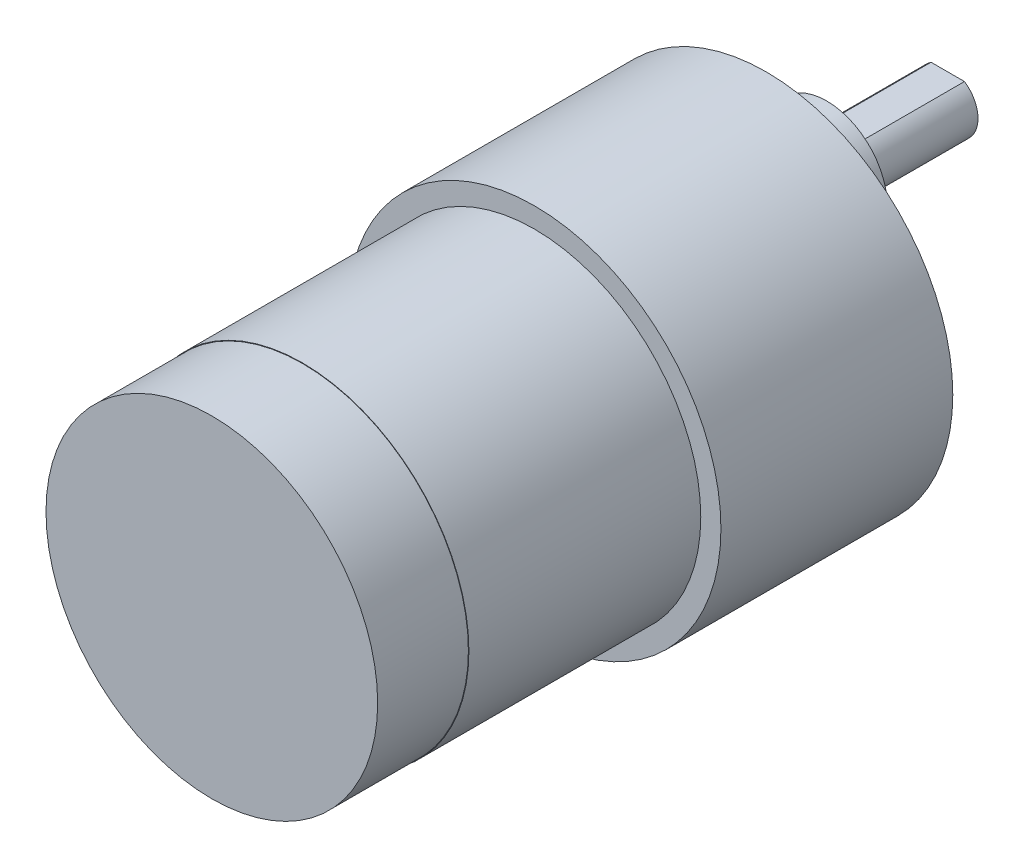
from build123d import *

# Parameters (mm, degrees)
SKETCH1_R           = 18.5
BOSS_EXTRUDE1_DEPTH = 23
SKETCH2_R           = 16.5
BOSS_EXTRUDE2_DEPTH = 23
SKETCH3_R           = 6
BOSS_EXTRUDE3_DEPTH = 6
SKETCH4_R           = 3
BOSS_EXTRUDE4_DEPTH = 12
SKETCH5_W           = 6
SKETCH5_H           = 11.5
CUT_EXTRUDE1_DEPTH  = 12
CIRPATTERN1_COUNT   = 6
SKETCH9_R           = 16.45
BOSS_EXTRUDE5_DEPTH = 9


with BuildPart() as part:
    # Sketch1 → Boss-Extrude1 (new body)
    with BuildSketch(Plane.XY):
        Circle(SKETCH1_R)
    extrude(amount=BOSS_EXTRUDE1_DEPTH)

    # Sketch2 → Boss-Extrude2 (add)
    with BuildSketch(Plane.XY.offset(23)):
        Circle(SKETCH2_R)
    extrude(amount=BOSS_EXTRUDE2_DEPTH)

    # Sketch3 → Boss-Extrude3 (add)
    with BuildSketch(Plane(origin=(0, 0, 0), x_dir=(-1, 0, 0), z_dir=(0, 0, -1))):
        with Locations(Location((0, 7, 0), (0, 0, 180))):
            Circle(SKETCH3_R)
    extrude(amount=BOSS_EXTRUDE3_DEPTH)

    # Sketch4 → Boss-Extrude4 (add)
    with BuildSketch(Plane(origin=(0, 0, -6), x_dir=(-1, 0, 0), z_dir=(0, 0, -1))):
        with Locations((0, 7)):
            Circle(SKETCH4_R)
    extrude(amount=BOSS_EXTRUDE4_DEPTH)

    # Sketch5 → Cut-Extrude1 (cut)
    with BuildSketch(Plane(origin=(0, 9.5, 0), x_dir=(1, 0, 0), z_dir=(0, 1, 0))):
        with Locations((0, 12.25)):
            Rectangle(SKETCH5_W, SKETCH5_H)
    extrude(amount=CUT_EXTRUDE1_DEPTH, mode=Mode.SUBTRACT)

    # Sketch8 → M3 Tapped Hole1 (revolve, cut)
    with BuildSketch(Plane.YZ.offset(15.5)):
        Polygon((0, 0), (0, 5.751075774), (1.25, 5), (1.25, 0), align=None)
    m3_tapped_hole1 = revolve(axis=Axis((15.5, 0, -6.35), (0, 0, 1)), mode=Mode.SUBTRACT)

    # CirPattern1: M3 Tapped Hole1 ×6 about axis
    cirpattern1_axis = Axis((0, 0, 0), (0, 0, 1))
    for i in range(1, CIRPATTERN1_COUNT):
        add(m3_tapped_hole1.rotate(cirpattern1_axis, i * 360 / CIRPATTERN1_COUNT), mode=Mode.SUBTRACT)

    # Sketch9 → Boss-Extrude5 (add)
    with BuildSketch(Plane.XY.offset(46)):
        Circle(SKETCH9_R)
    extrude(amount=BOSS_EXTRUDE5_DEPTH)


solid = part.part
